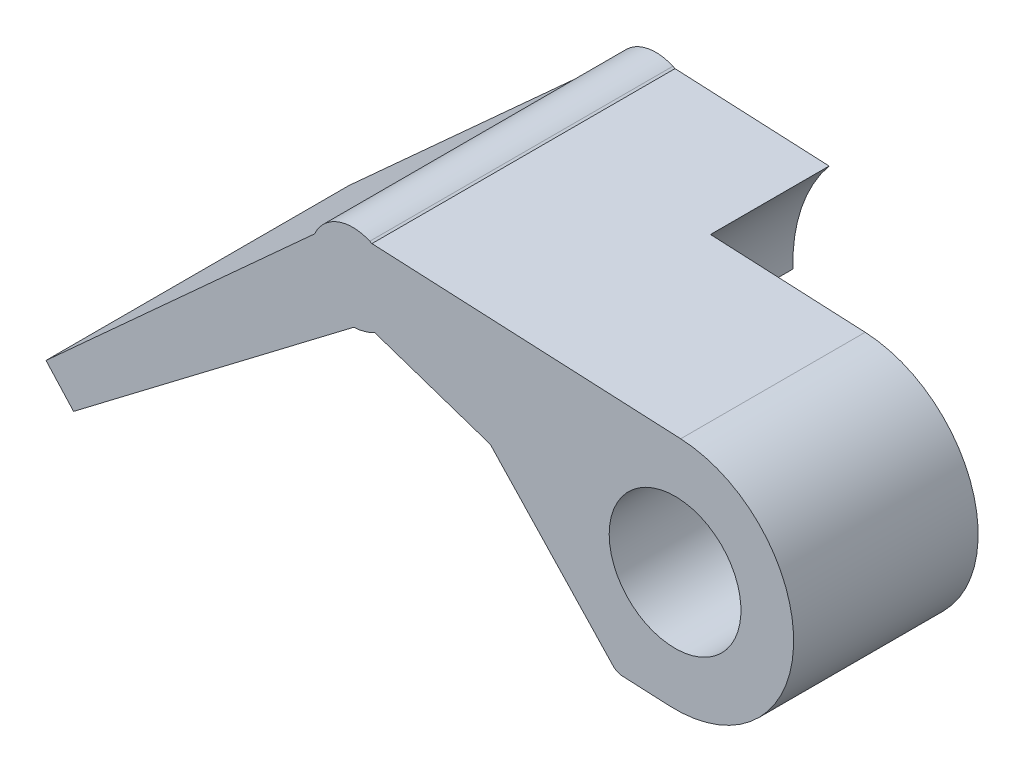
from build123d import *

# Parameters (mm, degrees)
BOSS_EXTRUDE1_DEPTH = 23
SKETCH4_R           = 5
CUT_EXTRUDE3_DEPTH  = 28
CUT_EXTRUDE4_DEPTH  = 9


with BuildPart() as part:
    # Sketch1 → Boss-Extrude1 (new body)
    with BuildSketch(Plane.XY):
        with BuildLine():
            Line((-26.278110913, -11.347842937), (-28.372166089, -9.043842083))
            Line((-28.372166089, -9.043842083), (-7.990208081, 9.462215656))
            ThreePointArc((-7.990208081, 9.462215656), (-6.229501786, 11.136017118), (-3.800938061, 11.07456612))
            Line((-3.800938061, 11.07456612), (-3.637536714, 11.001987755))
            Line((-3.637536714, 11.001987755), (19.793985679, 9.88969345))
            ThreePointArc((19.793985679, 9.88969345), (28.356197765, 0.474073738), (18.940578052, -8.088138348))
            Line((18.940578052, -8.088138348), (15.348738563, -7.91649311))
            ThreePointArc((15.348738563, -7.91649311), (14.978028358, -7.825889172), (14.668239185, -7.603030926))
            Line((14.668239185, -7.603030926), (5.35012395, 2.296550983))
            Line((5.35012395, 2.296550983), (-3.419163159, 5.255947346))
            ThreePointArc((-3.419163159, 5.255947346), (-4.191805611, 4.94513719), (-5.014133862, 4.813396687))
            Line((-5.014133862, 4.813396687), (-26.278110913, -11.347842937))
        make_face()
    extrude(amount=BOSS_EXTRUDE1_DEPTH)

    # Sketch4 → Cut-Extrude3 (cut)
    with BuildSketch(Plane(origin=(0, 0, 0), x_dir=(-1, 0, 0), z_dir=(0, 0, -1))):
        with Locations((-19.367281866, 0.900777551)):
            Circle(SKETCH4_R)
    extrude(amount=-CUT_EXTRUDE3_DEPTH, mode=Mode.SUBTRACT)

    # Sketch5 → Cut-Extrude4 (cut)
    with BuildSketch(Plane(origin=(0, 0, 0), x_dir=(-1, 0, 0), z_dir=(0, 0, -1))):
        with BuildLine():
            Line((-8.280771458, 10.715087027), (-20.34194177, 10.142544005))
            ThreePointArc((-20.34194177, 10.142544005), (-28.752978591, 0.302154859), (-18.904257366, -8.099124161))
            Line((-18.904257366, -8.099124161), (-15.316689911, -7.927683074))
            ThreePointArc((-15.316689911, -7.927683074), (-14.945947651, -7.837064321), (-14.636142172, -7.614169396))
            Line((-14.636142172, -7.614169396), (-5.318075302, 2.285361131))
            ThreePointArc((-5.318075302, 2.285361131), (-6.00282629, 6.780194646), (-8.280771458, 10.715087027))
        make_face()
    extrude(amount=-CUT_EXTRUDE4_DEPTH, mode=Mode.SUBTRACT)


solid = part.part
